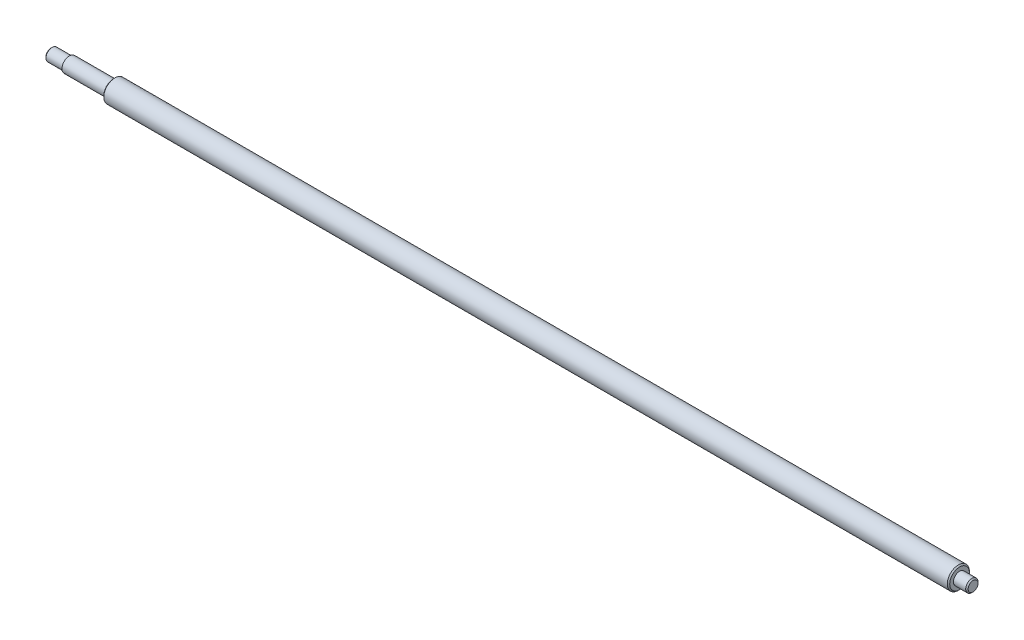
from build123d import *


with BuildPart() as part:
    # Sketch1 → Revolve1 (revolve)
    with BuildSketch(Plane(origin=(0, 0, 0), x_dir=(1, 0, 0), z_dir=(0, 1, 0)), mode=Mode.PRIVATE) as revolve1_sk:
        Polygon((-208.466913465, 0), (-208.466913465, 4), (-207.466913465, 5), (-193.466913465, 5), (-193.466913465, 6), (-157.466913465, 6), (-157.466913465, 8), (-156.466913465, 9), (529.533086535, 9), (530.533086535, 8), (530.533086535, 5), (540.533086535, 5), (541.533086535, 4), (541.533086535, 0), align=None)
    revolve(revolve1_sk.sketch.rotate(Axis((-222.96414574, 0, 0), (1, 0, 0)), 180), axis=Axis((-222.96414574, 0, 0), (1, 0, 0)))


solid = part.part
